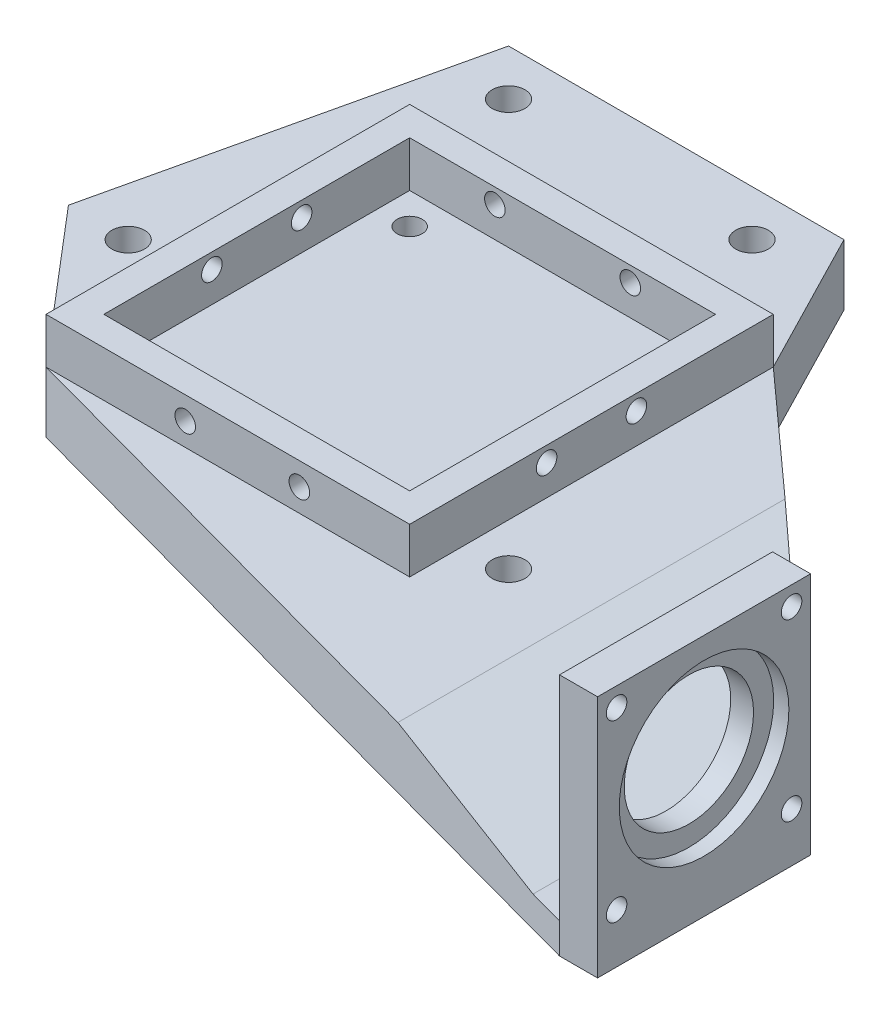
from build123d import *

# Parameters (mm, degrees)
SKETCH1_W            = 47.8
SKETCH1_H            = 47.8
SKETCH1_W_2          = 40.2
SKETCH1_H_2          = 40.2
BOSS_EXTRUDE1_DEPTH  = 6
CUT_EXTRUDE4_REACH   = 55.778
SKETCH6_R            = 1.35
CUT_EXTRUDE5_REACH   = 55.778
SKETCH7_R            = 1.35
SKETCH8_R            = 1.35
CUT_EXTRUDE6_DEPTH   = 54.777783517
SKETCH11_W           = 5
SKETCH11_H           = 28
SKETCH11_W_2         = 47.8
SKETCH11_H_2         = 47.8
SKETCH11_R           = 1.65
BOSS_EXTRUDE8_DEPTH  = 8
CUT_EXTRUDE7_DEPTH   = 105.25363303
SKETCH12_W           = 28
SKETCH12_H           = 28
SKETCH12_R           = 11.15
SKETCH12_R_2         = 1.35
SKETCH12_R_3         = 8.5
BOSS_EXTRUDE9_DEPTH  = 5
BOSS_EXTRUDE10_START = -2
SKETCH12_3_R         = 8.5
BOSS_EXTRUDE10_DEPTH = 3
SKETCH14_R           = 2.15
BOSS_EXTRUDE11_DEPTH = 8
SKETCH14_3_R         = 2.15
CUT_EXTRUDE8_DEPTH   = 10


with BuildPart() as part:
    # Sketch1 → Boss-Extrude1 (new body)
    with BuildSketch(Plane(origin=(0, 0, 0), x_dir=(1, 0, 0), z_dir=(0, 1, 0))):
        Rectangle(SKETCH1_W, SKETCH1_H)
        Rectangle(SKETCH1_W_2, SKETCH1_H_2, mode=Mode.SUBTRACT)
    extrude(amount=BOSS_EXTRUDE1_DEPTH)

    # Sketch6 → Cut-Extrude4 (cut, up to next)
    with BuildSketch(Plane(origin=(0, 0, -23.9), x_dir=(-1, 0, 0), z_dir=(0, 0, -1)), mode=Mode.PRIVATE) as cut_extrude4_sk1:
        with Locations((-8.9, 4)):
            Circle(SKETCH6_R)
    cut_extrude4_tool1 = extrude(cut_extrude4_sk1.sketch, amount=-CUT_EXTRUDE4_REACH, mode=Mode.PRIVATE) & part.part
    # Sketch6 → Cut-Extrude4 (cut, up to next)
    with BuildSketch(Plane(origin=(0, 0, -23.9), x_dir=(-1, 0, 0), z_dir=(0, 0, -1)), mode=Mode.PRIVATE) as cut_extrude4_sk2:
        with Locations((8.9, 4)):
            Circle(SKETCH6_R)
    cut_extrude4_tool2 = extrude(cut_extrude4_sk2.sketch, amount=-CUT_EXTRUDE4_REACH, mode=Mode.PRIVATE) & part.part
    add(cut_extrude4_tool1.solids().sort_by_distance((8.9, 4, -23.9))[0], mode=Mode.SUBTRACT)
    add(cut_extrude4_tool2.solids().sort_by_distance((-8.9, 4, -23.9))[0], mode=Mode.SUBTRACT)

    # Sketch7 → Cut-Extrude5 (cut, up to next)
    with BuildSketch(Plane.XY.offset(23.9), mode=Mode.PRIVATE) as cut_extrude5_sk1:
        with Locations((9.4, 3)):
            Circle(SKETCH7_R)
    cut_extrude5_tool1 = extrude(cut_extrude5_sk1.sketch, amount=-CUT_EXTRUDE5_REACH, mode=Mode.PRIVATE) & part.part
    # Sketch7 → Cut-Extrude5 (cut, up to next)
    with BuildSketch(Plane.XY.offset(23.9), mode=Mode.PRIVATE) as cut_extrude5_sk2:
        with Locations((-5.6, 3)):
            Circle(SKETCH7_R)
    cut_extrude5_tool2 = extrude(cut_extrude5_sk2.sketch, amount=-CUT_EXTRUDE5_REACH, mode=Mode.PRIVATE) & part.part
    add(cut_extrude5_tool1.solids().sort_by_distance((9.4, 3, 23.9))[0], mode=Mode.SUBTRACT)
    add(cut_extrude5_tool2.solids().sort_by_distance((-5.6, 3, 23.9))[0], mode=Mode.SUBTRACT)

    # Sketch8 → Cut-Extrude6 (cut, through all)
    with BuildSketch(Plane(origin=(23.9, 0, 0), x_dir=(0, 0, -1), z_dir=(1, 0, 0))):
        with Locations((-5.9, 4)):
            Circle(SKETCH8_R)
        with Locations(Location((5.9, 4, 0), (0, 0, 180))):
            Circle(SKETCH8_R)
    extrude(amount=-CUT_EXTRUDE6_DEPTH, mode=Mode.SUBTRACT)

    # Sketch11 → Boss-Extrude8 (add)
    # profile 1 of 3: a face of its own
    with BuildSketch(Plane(origin=(0, 0, 0), x_dir=(1, 0, 0), z_dir=(0, 1, 0))):
        Polygon((73.9, -21.2), (68.9, -21.2), (68.9, -49.2), (-23.9, -23.9), (23.9, -23.9), (23.9, 23.9), align=None)
    # profile 2 of 3: a face of its own
    with BuildSketch(Plane(origin=(0, 0, 0), x_dir=(1, 0, 0), z_dir=(0, 1, 0))):
        with Locations((71.4, -35.2)):
            Rectangle(SKETCH11_W, SKETCH11_H)
    # profile 3 of 3: a face of its own
    with BuildSketch(Plane(origin=(0, 0, 0), x_dir=(1, 0, 0), z_dir=(0, 1, 0))):
        Rectangle(SKETCH11_W_2, SKETCH11_H_2)
        with Locations(Location((-16, -16, 0), (0, 0, 270))):
            Circle(SKETCH11_R, mode=Mode.SUBTRACT)
        with Locations(Location((16, -16, 0), (0, 0, 270))):
            Circle(SKETCH11_R, mode=Mode.SUBTRACT)
        with Locations(Location((16, 16, 0), (0, 0, 270))):
            Circle(SKETCH11_R, mode=Mode.SUBTRACT)
        with Locations(Location((-16, 16, 0), (0, 0, 270))):
            Circle(SKETCH11_R, mode=Mode.SUBTRACT)
    extrude(amount=-BOSS_EXTRUDE8_DEPTH)

    # Sketch13 → Cut-Extrude7 (cut, through all)
    with BuildSketch(Plane.XY.offset(49.2)):
        Polygon((73.9, -3.987183479), (64.114380232, -3.987183479), (28.73812358, 1.78739259), (73.9, 1.78739259), align=None)
    extrude(amount=-CUT_EXTRUDE7_DEPTH, mode=Mode.SUBTRACT)

    # Sketch12 → Boss-Extrude9 (add)
    # profile 1 of 2: a face of its own
    with BuildSketch(Plane(origin=(73.9, 0, 0), x_dir=(0, 0, -1), z_dir=(1, 0, 0))):
        with Locations((-35.2, 10.012816521)):
            Rectangle(SKETCH12_W, SKETCH12_H)
        with Locations((-35.2, 10.012816521)):
            Circle(SKETCH12_R, mode=Mode.SUBTRACT)
        with Locations((-46.7, 21.512816521)):
            Circle(SKETCH12_R_2, mode=Mode.SUBTRACT)
        with Locations((-23.7, 21.512816521)):
            Circle(SKETCH12_R_2, mode=Mode.SUBTRACT)
        with Locations((-23.7, -1.487183479)):
            Circle(SKETCH12_R_2, mode=Mode.SUBTRACT)
        with Locations((-46.7, -1.487183479)):
            Circle(SKETCH12_R_2, mode=Mode.SUBTRACT)
    # profile 2 of 2: a face of its own
    with BuildSketch(Plane(origin=(73.9, 0, 0), x_dir=(0, 0, -1), z_dir=(1, 0, 0))):
        with Locations((-35.2, 10.012816521)):
            Circle(SKETCH12_R_3)
    extrude(amount=-BOSS_EXTRUDE9_DEPTH)


with BuildPart() as boss_extrude9_kept_piece:
    # of the separate pieces the step leaves, the one the design keeps (boss_extrude9_pieces_kept)
    add(part.part.solids().sort_by_distance((-23.9, 6, -23.9))[0])

    # Sketch12<3> → Boss-Extrude10 (add)
    # profile 1 of 2: a face of its own
    with BuildSketch(Plane(origin=(73.9, 0, 0), x_dir=(0, 0, -1), z_dir=(1, 0, 0)).offset(BOSS_EXTRUDE10_START)):
        with BuildLine():
            Line((-40.1057115, 0), (-30.2942885, 0))
            ThreePointArc((-30.2942885, 0), (-25.738996268, 4.112654795), (-24.05, 10.012816521))
            ThreePointArc((-24.05, 10.012816521), (-41.100161726, 19.473820253), (-40.1057115, 0))
        make_face()
        with Locations((-35.2, 10.012816521)):
            Circle(SKETCH12_3_R, mode=Mode.SUBTRACT)
    # profile 2 of 2: a face of its own
    with BuildSketch(Plane(origin=(73.9, 0, 0), x_dir=(0, 0, -1), z_dir=(1, 0, 0)).offset(BOSS_EXTRUDE10_START)):
        with BuildLine():
            ThreePointArc((-40.1057115, 0), (-35.2, -1.137183479), (-30.2942885, 0))
            Line((-30.2942885, 0), (-40.1057115, 0))
        make_face()
    extrude(amount=-BOSS_EXTRUDE10_DEPTH)

    # Sketch14 → Boss-Extrude11 (add)
    # profile 1 of 4: a face of its own
    with BuildSketch(Plane.XZ.offset(8)):
        with Locations((-24, -5)):
            Circle(SKETCH14_R)
    # profile 2 of 4: a face of its own
    with BuildSketch(Plane.XZ.offset(8)):
        Polygon((-23.9, 23.9), (-40.851983798, 4), (-30.045704848, -43.045704848), (14.045704848, -43.045704848), (23.9, -23.9), (-23.9, -23.9), align=None)
        with Locations(Location((-33, 4, 0), (0, 0, 270))):
            Circle(SKETCH14_R, mode=Mode.SUBTRACT)
        with Locations(Location((8, -37, 0), (0, 0, 270))):
            Circle(SKETCH14_R, mode=Mode.SUBTRACT)
        with Locations(Location((-24, -37, 0), (0, 0, 270))):
            Circle(SKETCH14_R, mode=Mode.SUBTRACT)
    # profile 3 of 4: a face of its own
    with BuildSketch(Plane.XZ.offset(8)):
        with BuildLine():
            ThreePointArc((-23.9, -2.852326841), (-26.15, -5), (-23.9, -7.147673159))
            Line((-23.9, -7.147673159), (-23.9, -2.852326841))
        make_face()
    # profile 4 of 4: a face of its own
    with BuildSketch(Plane.XZ.offset(8)):
        with BuildLine():
            Line((-23.9, -2.852326841), (-23.9, -7.147673159))
            ThreePointArc((-23.9, -7.147673159), (-22.444766899, -6.484503284), (-21.85, -5))
            ThreePointArc((-21.85, -5), (-22.444766899, -3.515496716), (-23.9, -2.852326841))
        make_face()
    extrude(amount=-BOSS_EXTRUDE11_DEPTH)

    # Sketch14<3> → Cut-Extrude8 (cut)
    with BuildSketch(Plane.XZ.offset(8)):
        with Locations(Location((29.5, 16.5, 0), (0, 0, 270))):
            Circle(SKETCH14_3_R)
    extrude(amount=-CUT_EXTRUDE8_DEPTH, mode=Mode.SUBTRACT)


solid = boss_extrude9_kept_piece.part
